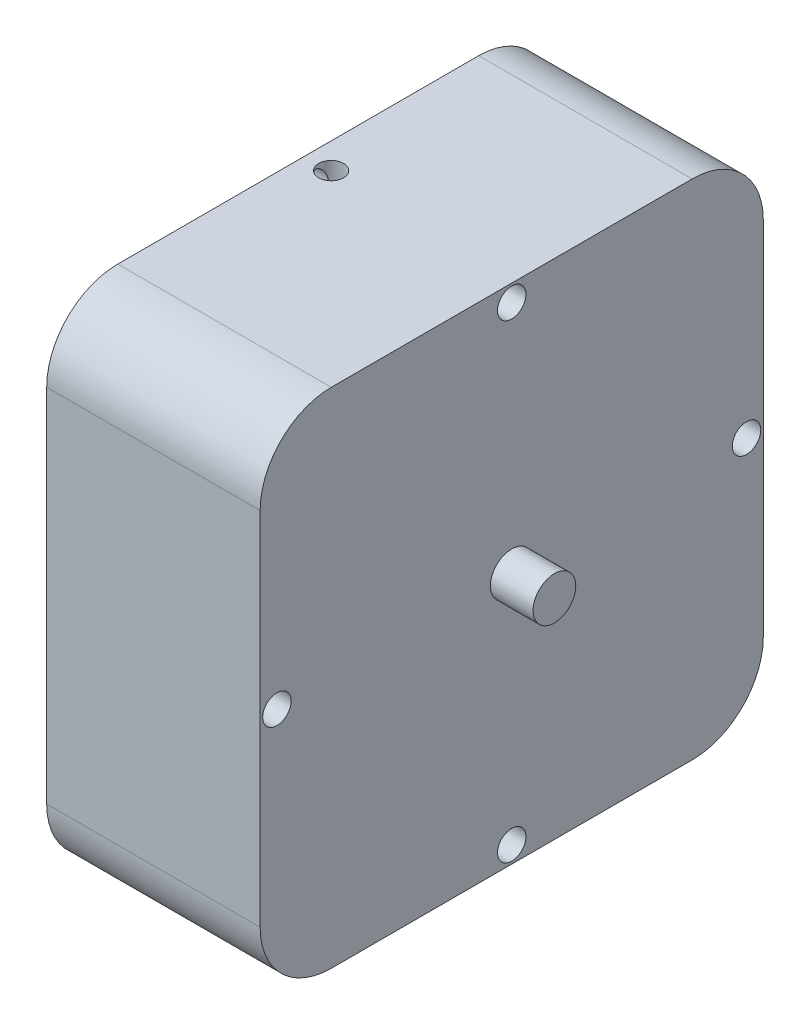
from build123d import *

# Parameters (mm, degrees)
SKETCH_1_W               = 70.72
SKETCH_1_H               = 70.72
EXTRUDE_1_DEPTH          = 30
SKETCH_2_R               = 3
CUT_EXTRUDE_1_DEPTH      = 6
SKETCH_3_R               = 3
EXTRUDE_2_DEPTH          = 6
SKETCH_5_R               = 1.75
CUT_EXTRUDE_2_DEPTH      = 6
CUT_EXTRUDE_3_DEPTH      = 59.315171268
CUT_EXTRUDE_3_DEPTH_BACK = 59.315171268
SKETCH_7_R               = 2
FILLET_1_R               = 10
FILLET_2_R               = 10
FILLET_3_R               = 10
FILLET_4_R               = 10


with BuildPart() as part:
    # 草图1 → 凸台-拉伸1 (new body)
    with BuildSketch(Plane(origin=(0, 0, 0), x_dir=(0, 0, -1), z_dir=(1, 0, 0))):
        Rectangle(SKETCH_1_W, SKETCH_1_H)
    extrude(amount=EXTRUDE_1_DEPTH)

    # 草图2 → 切除-拉伸1 (cut)
    with BuildSketch(Plane.ZY):
        Circle(SKETCH_2_R)
    extrude(amount=-CUT_EXTRUDE_1_DEPTH, mode=Mode.SUBTRACT)

    # 草图3 → 凸台-拉伸2 (add)
    with BuildSketch(Plane(origin=(30, 0, 0), x_dir=(0, 0, -1), z_dir=(1, 0, 0))):
        with Locations(Location((0, 0, 0), (0, 0, 180))):
            Circle(SKETCH_3_R)
    extrude(amount=EXTRUDE_2_DEPTH)

    # 草图5 → 切除-拉伸2 (cut)
    with BuildSketch(Plane(origin=(0, 35.36, 0), x_dir=(1, 0, 0), z_dir=(0, 1, 0))):
        with Locations(Location((3.62, 1, 0), (0, 0, 270))):
            Circle(SKETCH_5_R)
    extrude(amount=-CUT_EXTRUDE_2_DEPTH, mode=Mode.SUBTRACT)

    # 草图7 → 切除-拉伸3 (cut, two sides: drawn at the far end of the back side and taken through both)
    with BuildSketch(Plane.ZY.offset(-6).offset(-CUT_EXTRUDE_3_DEPTH_BACK)):
        with Locations((0, 33)):
            Circle(SKETCH_7_R)
        with Locations((33, 0)):
            Circle(SKETCH_7_R)
        with Locations((0, -33)):
            Circle(SKETCH_7_R)
        with Locations((-33, 0)):
            Circle(SKETCH_7_R)
    extrude(amount=CUT_EXTRUDE_3_DEPTH + CUT_EXTRUDE_3_DEPTH_BACK, mode=Mode.SUBTRACT)

    # 圆角1
    fillet_1_edges = [part.edges().sort_by_distance(p)[0] for p in [
        (15, 35.36, -35.36),
    ]]
    fillet(fillet_1_edges, radius=FILLET_1_R)

    # 圆角2
    fillet_2_edges = [part.edges().sort_by_distance(p)[0] for p in [
        (15, -35.36, -35.36),
    ]]
    fillet(fillet_2_edges, radius=FILLET_2_R)

    # 圆角3
    fillet_3_edges = [part.edges().sort_by_distance(p)[0] for p in [
        (15, -35.36, 35.36),
    ]]
    fillet(fillet_3_edges, radius=FILLET_3_R)

    # 圆角4
    fillet_4_edges = [part.edges().sort_by_distance(p)[0] for p in [
        (15, 35.36, 35.36),
    ]]
    fillet(fillet_4_edges, radius=FILLET_4_R)


solid = part.part
